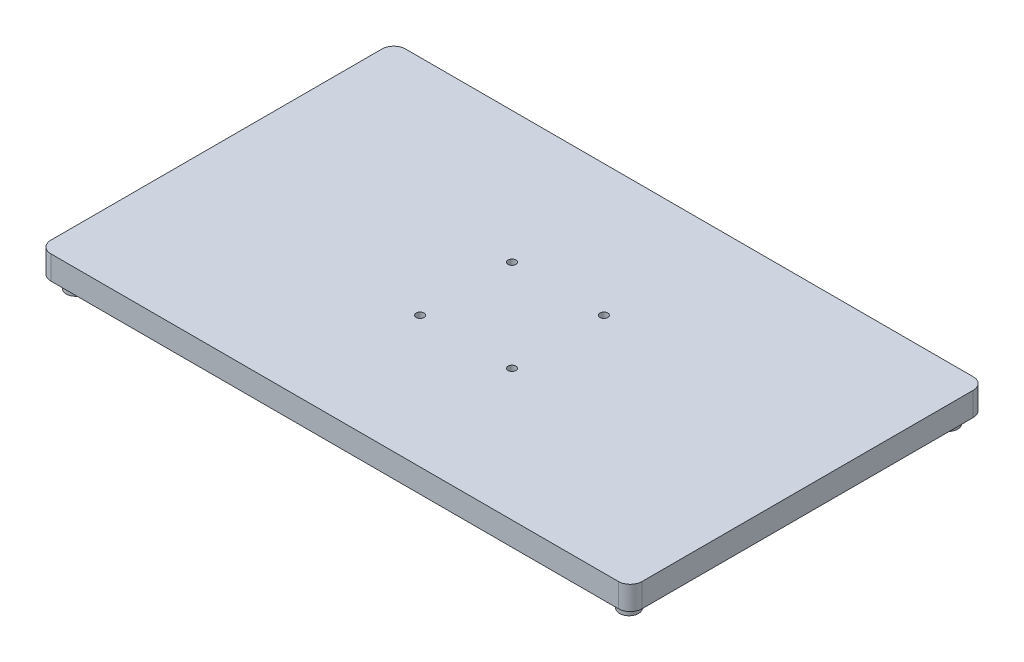
from build123d import *

# Parameters (mm, degrees)
BOSS_EXTRUDE1_DEPTH     = 20
CUT_EXTRUDE2_DEPTH      = 20
CUT_EXTRUDE2_DEPTH_BACK = 293.232783924
SKETCH2_R               = 3.3
SKETCH3_R               = 8
BOSS_EXTRUDE2_DEPTH     = 10


with BuildPart() as part:
    # Sketch1 → Boss-Extrude1 (new body)
    with BuildSketch(Plane(origin=(0, 0, 0), x_dir=(1, 0, 0), z_dir=(0, 1, 0))):
        with BuildLine():
            Line((240, -150), (-240, -150))
            ThreePointArc((-240, -150), (-247.071067812, -147.071067812), (-250, -140))
            Line((-250, -140), (-250, 140))
            ThreePointArc((-250, 140), (-247.071067812, 147.071067812), (-240, 150))
            Line((-240, 150), (240, 150))
            ThreePointArc((240, 150), (247.071067812, 147.071067812), (250, 140))
            Line((250, 140), (250, -140))
            ThreePointArc((250, -140), (247.071067812, -147.071067812), (240, -150))
        make_face()
    extrude(amount=BOSS_EXTRUDE1_DEPTH)

    # Sketch2 → Cut-Extrude2 (cut, two sides: drawn at the far end of the back side and taken through both)
    with BuildSketch(Plane(origin=(0, 0, 0), x_dir=(1, 0, 0), z_dir=(0, 1, 0)).offset(-CUT_EXTRUDE2_DEPTH_BACK)):
        with Locations(Location((-38.87, -38.87, 0), (0, 0, 270))):
            Circle(SKETCH2_R)
        with Locations(Location((38.87, -38.87, 0), (0, 0, 270))):
            Circle(SKETCH2_R)
        with Locations(Location((38.87, 38.87, 0), (0, 0, 270))):
            Circle(SKETCH2_R)
        with Locations(Location((-38.87, 38.87, 0), (0, 0, 270))):
            Circle(SKETCH2_R)
    extrude(amount=CUT_EXTRUDE2_DEPTH + CUT_EXTRUDE2_DEPTH_BACK, mode=Mode.SUBTRACT)

    # Sketch3 → Boss-Extrude2 (add)
    with BuildSketch(Plane(origin=(0, 0, 0), x_dir=(1, 0, 0), z_dir=(0, 1, 0))):
        with Locations(Location((-234, 135, 0), (0, 0, 270))):
            Circle(SKETCH3_R)
        with Locations(Location((234, 135, 0), (0, 0, 270))):
            Circle(SKETCH3_R)
        with Locations(Location((234, -135, 0), (0, 0, 270))):
            Circle(SKETCH3_R)
        with Locations(Location((-234, -135, 0), (0, 0, 270))):
            Circle(SKETCH3_R)
    extrude(amount=-BOSS_EXTRUDE2_DEPTH)


solid = part.part
